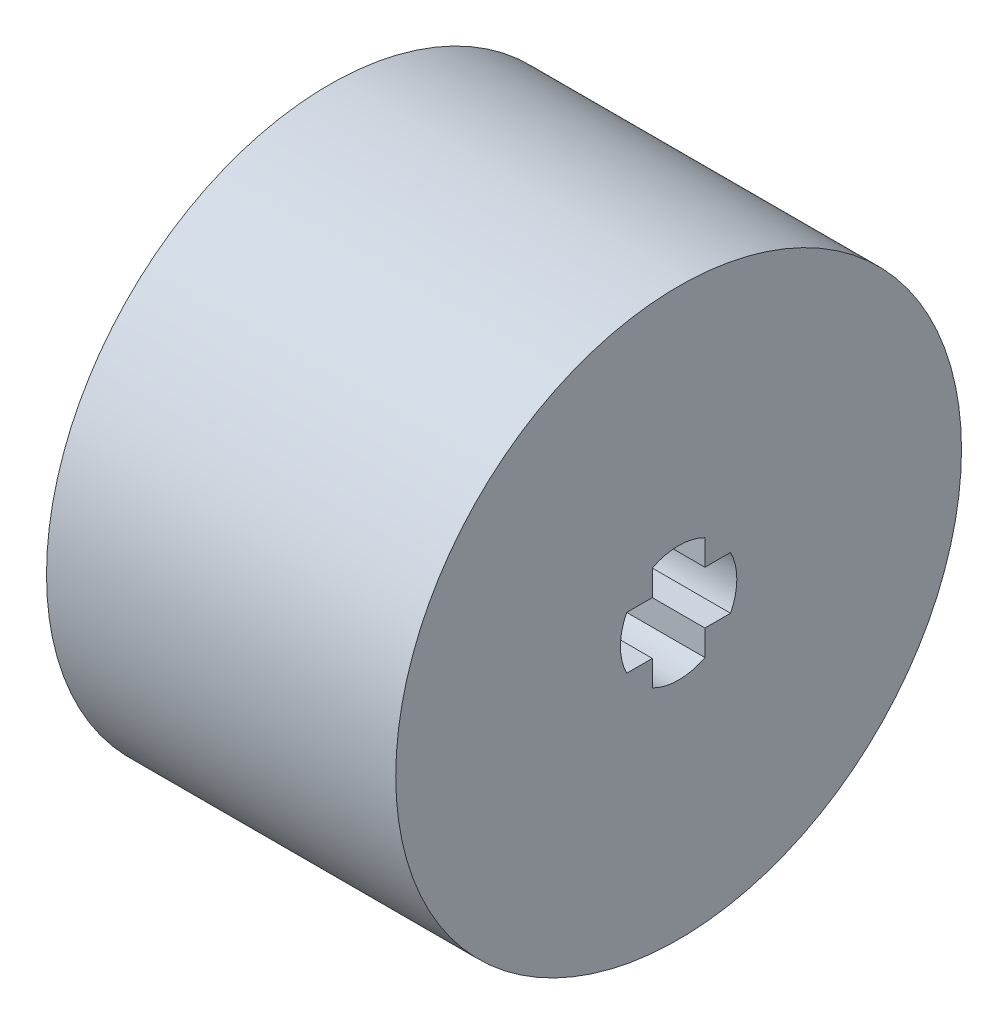
from build123d import *

# Parameters (mm, degrees)
SKETCH_1_R          = 12.15
EXTRUDE_1_DEPTH     = 15
SKETCH_2_W          = 2.260059524
SKETCH_2_H          = 1.1
SKETCH_2_W_2        = 1.1
SKETCH_2_H_2        = 2.260059524
CUT_EXTRUDE_1_DEPTH = 23.80887985
SKETCH_3_R          = 7.5
CUT_EXTRUDE_2_DEPTH = 4
SKETCH_4_R          = 4
CUT_EXTRUDE_3_DEPTH = 3


with BuildPart() as part:
    # 草图1 → 凸台-拉伸1 (new body)
    with BuildSketch(Plane(origin=(0, 0, 0), x_dir=(0, 0, -1), z_dir=(1, 0, 0))):
        Circle(SKETCH_1_R)
    extrude(amount=EXTRUDE_1_DEPTH)

    # 草图2 → 切除-拉伸1 (cut, through all)
    with BuildSketch(Plane(origin=(15, 0, 0), x_dir=(0, 0, -1), z_dir=(1, 0, 0))):
        with Locations((0, 1.680029762)):
            Rectangle(SKETCH_2_W, SKETCH_2_H)
        with Locations((-1.680029762, 0)):
            Rectangle(SKETCH_2_W_2, SKETCH_2_H_2)
        with Locations((0, -1.680029762)):
            Rectangle(SKETCH_2_W, SKETCH_2_H)
        with Locations((1.680029762, 0)):
            Rectangle(SKETCH_2_W_2, SKETCH_2_H_2)
        Rectangle(SKETCH_2_W, SKETCH_2_H_2)
        with BuildLine():
            ThreePointArc((1.130029762, 2.230029762), (0, 2.5), (-1.130029762, 2.230029762))
            Line((-1.130029762, 2.230029762), (1.130029762, 2.230029762))
        make_face()
        with BuildLine():
            ThreePointArc((2.5, 0), (2.431570933, 0.580915483), (2.230029762, 1.130029762))
            Line((2.230029762, 1.130029762), (2.230029762, -1.130029762))
            ThreePointArc((2.230029762, -1.130029762), (2.431570933, -0.580915483), (2.5, 0))
        make_face()
        with BuildLine():
            Line((1.130029762, -2.230029762), (-1.130029762, -2.230029762))
            ThreePointArc((-1.130029762, -2.230029762), (0, -2.5), (1.130029762, -2.230029762))
        make_face()
        with BuildLine():
            Line((-2.230029762, -1.130029762), (-2.230029762, 1.130029762))
            ThreePointArc((-2.230029762, 1.130029762), (-2.5, 0), (-2.230029762, -1.130029762))
        make_face()
    extrude(amount=-CUT_EXTRUDE_1_DEPTH, mode=Mode.SUBTRACT)

    # 草图3 → 切除-拉伸2 (cut)
    with BuildSketch(Plane.ZY):
        Circle(SKETCH_3_R)
    extrude(amount=-CUT_EXTRUDE_2_DEPTH, mode=Mode.SUBTRACT)

    # 草图4 → 切除-拉伸3 (cut)
    with BuildSketch(Plane.ZY.offset(-4)):
        Circle(SKETCH_4_R)
    extrude(amount=-CUT_EXTRUDE_3_DEPTH, mode=Mode.SUBTRACT)


solid = part.part
